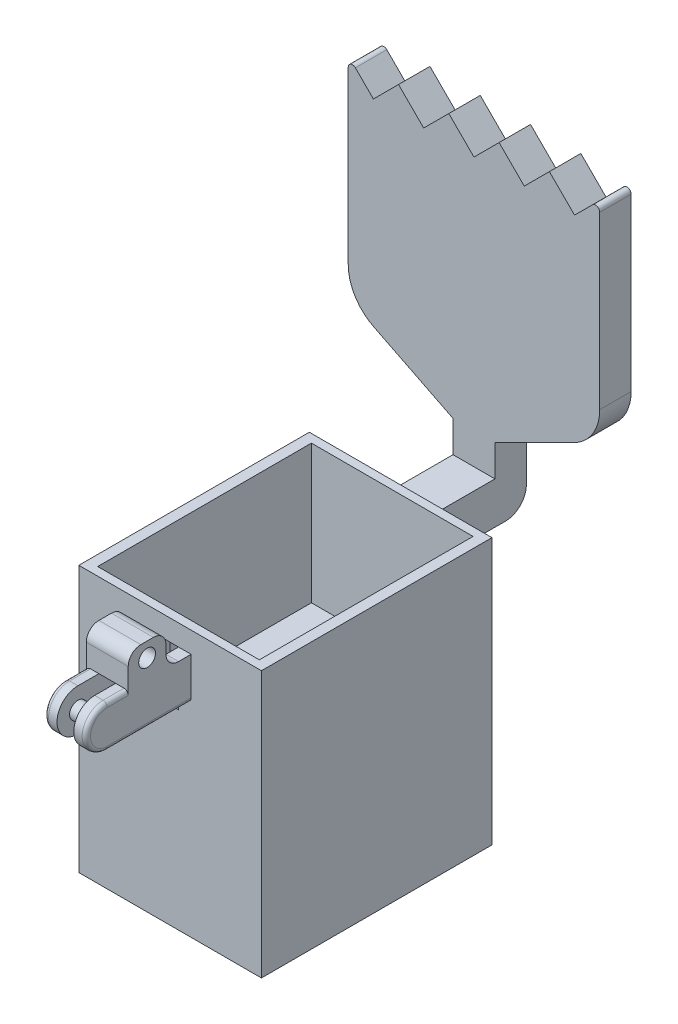
from build123d import *

# Parameters (mm, degrees)
SKETCH1_W           = 43.57
SKETCH1_H           = 63.5
BOSS_EXTRUDE1_DEPTH = 55
CUT_EXTRUDE2_DEPTH  = 95.634004988
SKETCH4_W           = 43.57
SKETCH4_H           = 55
SKETCH4_W_2         = 6
SKETCH4_H_2         = 15
BOSS_EXTRUDE2_DEPTH = 9
SKETCH5_R           = 1
CUT_EXTRUDE3_DEPTH  = 1
BOSS_EXTRUDE3_START = -26.785
BOSS_EXTRUDE3_DEPTH = 10
SKETCH7_R           = 2
CUT_EXTRUDE4_DEPTH  = 2
SKETCH13_W          = 9
SKETCH13_H          = 8
BOSS_EXTRUDE6_DEPTH = 10
FILLET12_R          = 3
FILLET2_R           = 1
BOSS_EXTRUDE4_DEPTH = 10
BOSS_EXTRUDE5_DEPTH = 7.5
CUT_EXTRUDE11_DEPTH = 174.835946297
LPATTERN1_COUNT     = 5
LPATTERN1_PITCH     = 12
FILLET9_R           = 1
FILLET11_R          = 11
SKETCH14_R          = 2
CUT_EXTRUDE12_DEPTH = 156.361674811
SKETCH15_W          = 15
SKETCH15_H          = 33
CUT_EXTRUDE13_DEPTH = 33
SKETCH16_W          = 15
SKETCH16_H          = 25
CUT_EXTRUDE14_DEPTH = 26
SKETCH18_R          = 0.8
CUT_EXTRUDE15_DEPTH = 8
SKETCH19_W          = 15
SKETCH19_H          = 5
CUT_EXTRUDE16_DEPTH = 25
SKETCH20_W          = 38.57
SKETCH20_H          = 51
CUT_EXTRUDE17_DEPTH = 33
SKETCH21_W          = 4
SKETCH21_H          = 13
CUT_EXTRUDE18_DEPTH = 27


with BuildPart() as part:
    # Sketch1 → Boss-Extrude1 (new body)
    with BuildSketch(Plane.XY):
        with Locations((21.785, 31.75)):
            Rectangle(SKETCH1_W, SKETCH1_H)
    extrude(amount=BOSS_EXTRUDE1_DEPTH)

    # Sketch3 → Cut-Extrude2 (cut, through all)
    with BuildSketch(Plane(origin=(43.57, 0, 0), x_dir=(0, 0, -1), z_dir=(1, 0, 0))):
        with BuildLine():
            Line((-29.5, 0), (-29.5, 1.5))
            ThreePointArc((-29.5, 1.5), (-29.060660172, 2.560660172), (-28, 3))
            Line((-28, 3), (-27, 3))
            ThreePointArc((-27, 3), (-25.939339828, 2.560660172), (-25.5, 1.5))
            Line((-25.5, 1.5), (-25.5, 0))
            Line((-25.5, 0), (-22.5, 0))
            Line((-22.5, 0), (-22.5, 3.5))
            ThreePointArc((-22.5, 3.5), (-22.939339828, 4.560660172), (-24, 5))
            Line((-24, 5), (-31, 5))
            ThreePointArc((-31, 5), (-32.060660172, 4.560660172), (-32.5, 3.5))
            Line((-32.5, 3.5), (-32.5, 0))
            Line((-32.5, 0), (-29.5, 0))
        make_face()
    extrude(amount=-CUT_EXTRUDE2_DEPTH, mode=Mode.SUBTRACT)


with BuildPart() as cut_extrude2_piece_1:
    # of the separate pieces the step leaves, piece 1, a body of its own (cut_extrude2_pieces)
    add(part.part.solids().sort_by_distance((0, 0, 0))[0])



with BuildPart() as cut_extrude2_piece_2:
    # of the separate pieces the step leaves, piece 2, a body of its own (cut_extrude2_pieces)
    add(part.part.solids().sort_by_distance((43.57, 0, 25.5))[0])


with BuildPart() as cut_extrude2_piece_1_1:
    add(cut_extrude2_piece_1.part)

    add(cut_extrude2_piece_2.part)  # Boss-Extrude2 merges Cut-Extrude2 piece 2
    # Sketch4 → Boss-Extrude2 (add)
    with BuildSketch(Plane.XZ):
        with Locations((21.785, 27.5)):
            Rectangle(SKETCH4_W, SKETCH4_H)
        with Locations((10.785, 27.5)):
            Rectangle(SKETCH4_W_2, SKETCH4_H_2, mode=Mode.SUBTRACT)
        with Locations((32.785, 27.5)):
            Rectangle(SKETCH4_W_2, SKETCH4_H_2, mode=Mode.SUBTRACT)
    extrude(amount=-BOSS_EXTRUDE2_DEPTH)

    # Sketch5 → Cut-Extrude3 (cut)
    with BuildSketch(Plane(origin=(0, 0, 0), x_dir=(-1, 0, 0), z_dir=(0, -1, 0))):
        with Locations(Location((-21.785, -27.5, 0), (0, 0, 90))):
            Circle(SKETCH5_R)
    extrude(amount=-CUT_EXTRUDE3_DEPTH, mode=Mode.SUBTRACT)

    # Sketch6 → Boss-Extrude3 (add)
    with BuildSketch(Plane.ZY.offset(BOSS_EXTRUDE3_START)):
        with BuildLine():
            Line((55, 48.5), (75, 48.5))
            ThreePointArc((75, 48.5), (80, 53.5), (75, 58.5))
            Line((75, 58.5), (55, 58.5))
            ThreePointArc((55, 58.5), (50, 53.5), (55, 48.5))
        make_face()
    boss_extrude3 = extrude(amount=BOSS_EXTRUDE3_DEPTH)

    # Mirror1: Boss-Extrude3 across plane
    add(boss_extrude3.mirror(Plane(origin=(0, 0, 27.5), x_dir=(1, 0, 0), z_dir=(0, 0, -1))))

    # Sketch7 → Cut-Extrude4 (cut, symmetric)
    # profile 1 of 3: a face of its own
    with BuildSketch(Plane.ZY.offset(-21.785)):
        with BuildLine():
            ThreePointArc((75, 58.5), (71.464466094, 57.035533906), (70, 53.5))
            ThreePointArc((70, 53.5), (71.464466094, 49.964466094), (75, 48.5))
            ThreePointArc((75, 48.5), (78.535533906, 49.964466094), (80, 53.5))
            ThreePointArc((80, 53.5), (78.535533906, 57.035533906), (75, 58.5))
        make_face()
        with Locations(Location((75, 53.5, 0), (0, 0, 270))):
            Circle(SKETCH7_R, mode=Mode.SUBTRACT)
    # profile 2 of 3: a face of its own
    with BuildSketch(Plane.ZY.offset(-21.785)):
        with BuildLine():
            Line((70, 58.5), (70, 53.5))
            ThreePointArc((70, 53.5), (71.464466094, 57.035533906), (75, 58.5))
            Line((75, 58.5), (70, 58.5))
        make_face()
    # profile 3 of 3: a face of its own
    with BuildSketch(Plane.ZY.offset(-21.785)):
        with BuildLine():
            ThreePointArc((75, 48.5), (71.464466094, 49.964466094), (70, 53.5))
            Line((70, 53.5), (70, 48.5))
            Line((70, 48.5), (75, 48.5))
        make_face()
    extrude(amount=CUT_EXTRUDE4_DEPTH, both=True, mode=Mode.SUBTRACT)

    # Sketch13 → Boss-Extrude6 (add)
    with BuildSketch(Plane(origin=(26.785, 0, 0), x_dir=(0, 0, -1), z_dir=(1, 0, 0))):
        with Locations((-65.5, 62.5)):
            Rectangle(SKETCH13_W, SKETCH13_H)
    extrude(amount=-BOSS_EXTRUDE6_DEPTH)

    # Fillet12
    fillet12_edges = [cut_extrude2_piece_1_1.edges().sort_by_distance(p)[0] for p in [
        (21.785, 66.5, 61),
        (21.785, 66.5, 70),
        (21.785, 58.5, 61),
    ]]
    fillet(fillet12_edges, radius=FILLET12_R)

    # Fillet2
    fillet2_edges = [cut_extrude2_piece_1_1.edges().sort_by_distance(p)[0] for p in [
        (16.785, 48.5, 65),
        (16.785, 53.5, 80),
        (16.785, 58.5, 72.5),
        (26.785, 48.5, 65),
        (26.785, 53.5, 80),
        (26.785, 58.5, 72.5),
    ]]
    fillet(fillet2_edges, radius=FILLET2_R)

    # Sketch10 → Boss-Extrude4 (add)
    with BuildSketch(Plane.ZY.offset(-16.785)):
        with BuildLine():
            Line((-25, 53.5), (-25, 78.5))
            Line((-25, 78.5), (-17.5, 78.5))
            Line((-17.5, 78.5), (-17.5, 58.5))
            Line((-17.5, 58.5), (-20, 58.5))
            ThreePointArc((-20, 58.5), (-23.535533906, 57.035533906), (-25, 53.5))
        make_face()
    extrude(amount=-BOSS_EXTRUDE4_DEPTH)

    # Sketch11 → Boss-Extrude5 (add)
    with BuildSketch(Plane(origin=(0, 0, -25), x_dir=(-1, 0, 0), z_dir=(0, 0, -1))):
        Polygon((-21.785, 63.5), (8.215, 78.5), (8.215, 128.5), (-51.785, 128.5), (-51.785, 78.5), align=None)
    extrude(amount=-BOSS_EXTRUDE5_DEPTH)

    # Sketch12 → Cut-Extrude11 (cut, through all)
    with BuildSketch(Plane(origin=(0, 0, -25), x_dir=(-1, 0, 0), z_dir=(0, 0, -1))):
        Polygon((-51.785, 128.5), (-45.785, 122.5), (-39.785, 128.5), align=None)
    cut_extrude11 = extrude(amount=-CUT_EXTRUDE11_DEPTH, mode=Mode.SUBTRACT)

    # LPattern1: Cut-Extrude11 ×5
    with Locations(*[(-i * LPATTERN1_PITCH, 0, 0) for i in range(1, LPATTERN1_COUNT)]):
        add(cut_extrude11, mode=Mode.SUBTRACT)

    # Fillet9
    fillet9_edges = [cut_extrude2_piece_1_1.edges().sort_by_distance(p)[0] for p in [
        (-8.215, 128.5, -21.25),
        (51.785, 128.5, -21.25),
    ]]
    fillet(fillet9_edges, radius=FILLET9_R)

    # Fillet11
    fillet11_edges = [cut_extrude2_piece_1_1.edges().sort_by_distance(p)[0] for p in [
        (-8.215, 78.5, -21.25),
        (51.785, 78.5, -21.25),
    ]]
    fillet(fillet11_edges, radius=FILLET11_R)

    # Sketch14 → Cut-Extrude12 (cut, through all)
    with BuildSketch(Plane.ZY.offset(-16.785)):
        with Locations(Location((65.5, 63, 0), (0, 0, 270))):
            Circle(SKETCH14_R)
    extrude(amount=-CUT_EXTRUDE12_DEPTH, mode=Mode.SUBTRACT)

    # Sketch15 → Cut-Extrude13 (cut)
    with BuildSketch(Plane(origin=(0, 63.5, 0), x_dir=(1, 0, 0), z_dir=(0, 1, 0))):
        with Locations((21.785, -27.5)):
            Rectangle(SKETCH15_W, SKETCH15_H)
    extrude(amount=-CUT_EXTRUDE13_DEPTH, mode=Mode.SUBTRACT)

    # Sketch16 → Cut-Extrude14 (cut)
    with BuildSketch(Plane(origin=(0, 30.5, 0), x_dir=(1, 0, 0), z_dir=(0, 1, 0))):
        with Locations((21.785, -27.5)):
            Rectangle(SKETCH16_W, SKETCH16_H)
    extrude(amount=-CUT_EXTRUDE14_DEPTH, mode=Mode.SUBTRACT)

    # Sketch18 → Cut-Extrude15 (cut)
    with BuildSketch(Plane(origin=(0, 30.5, 0), x_dir=(1, 0, 0), z_dir=(0, 1, 0))):
        with Locations(Location((21.785, -13.6, 0), (0, 0, 270))):
            Circle(SKETCH18_R)
        with Locations(Location((21.785, -41.4, 0), (0, 0, 270))):
            Circle(SKETCH18_R)
    extrude(amount=-CUT_EXTRUDE15_DEPTH, mode=Mode.SUBTRACT)

    # Sketch19 → Cut-Extrude16 (cut)
    with BuildSketch(Plane(origin=(0, 4.5, 0), x_dir=(1, 0, 0), z_dir=(0, 1, 0))):
        with Locations((21.785, -17.5)):
            Rectangle(SKETCH19_W, SKETCH19_H)
    extrude(amount=-CUT_EXTRUDE16_DEPTH, mode=Mode.SUBTRACT)

    # Sketch20 → Cut-Extrude17 (cut)
    with BuildSketch(Plane(origin=(0, 63.5, 0), x_dir=(1, 0, 0), z_dir=(0, 1, 0))):
        with Locations((21.785, -27.5)):
            Rectangle(SKETCH20_W, SKETCH20_H)
    extrude(amount=-CUT_EXTRUDE17_DEPTH, mode=Mode.SUBTRACT)

    # Sketch21 → Cut-Extrude18 (cut)
    with BuildSketch(Plane.XY.offset(70)):
        with Locations((21.785, 52)):
            Rectangle(SKETCH21_W, SKETCH21_H)
    extrude(amount=-CUT_EXTRUDE18_DEPTH, mode=Mode.SUBTRACT)


solid = cut_extrude2_piece_1_1.part
